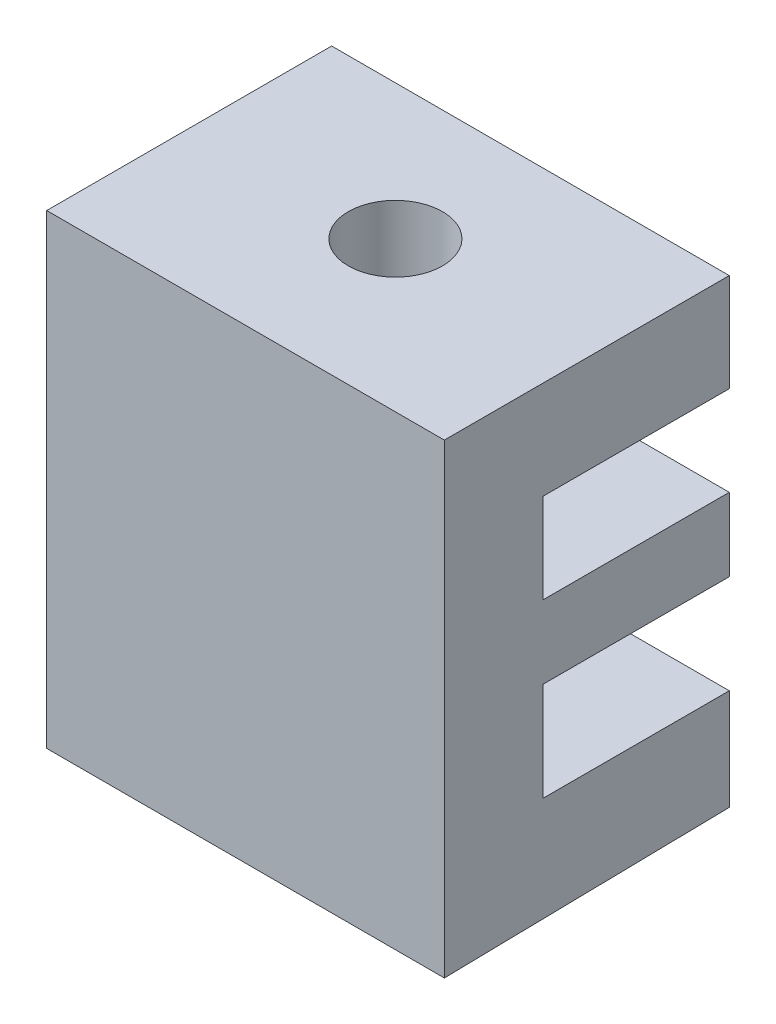
from build123d import *

# Parameters (mm, degrees)
BOSS_EXTRUDE1_DEPTH = 50
SKETCH2_R           = 11.83848923
CUT_EXTRUDE1_DEPTH  = 100.430977097


with BuildPart() as part:
    # Sketch1 → Boss-Extrude1 (new, symmetric)
    with BuildSketch(Plane(origin=(0, 0, 0), x_dir=(0, 0, -1), z_dir=(1, 0, 0))):
        Polygon((0, 53.746712803), (0, -49.386309295), (71.662283737, -48.059229966), (71.662283737, -22.655139964), (24.835341718, -22.655139964), (24.835341718, 2.180201754), (71.662283737, 2.180201754), (71.662283737, 20.569729591), (24.835341718, 20.569729591), (24.835341718, 43.130078175), (71.662283737, 43.130078175), (71.662283737, 67.775837132), (0, 67.775837132), align=None)
    extrude(amount=BOSS_EXTRUDE1_DEPTH, both=True)

    # Sketch2 → Cut-Extrude1 (cut)
    with BuildSketch(Plane(origin=(0, 67.775837132, 0), x_dir=(1, 0, 0), z_dir=(0, 1, 0))):
        with Locations(Location((0, 37.695226778, 0), (0, 0, 270))):
            Circle(SKETCH2_R)
    extrude(amount=-CUT_EXTRUDE1_DEPTH, mode=Mode.SUBTRACT)


solid = part.part
